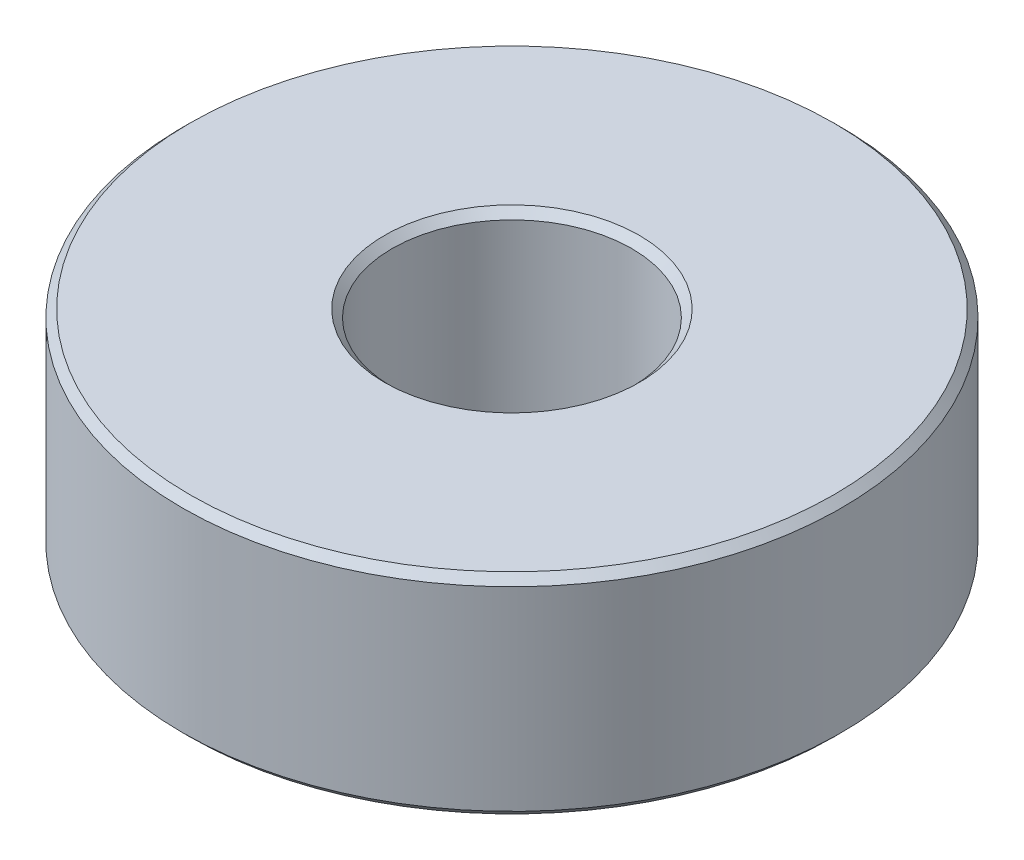
from build123d import *

# Parameters (mm, degrees)
SKETCH1_R           = 11
SKETCH1_R_2         = 4
BOSS_EXTRUDE1_DEPTH = 7
CHAMFER1_SIZE       = 0.254


with BuildPart() as part:
    # Sketch1 → Boss-Extrude1 (new body)
    with BuildSketch(Plane(origin=(0, 0, 0), x_dir=(1, 0, 0), z_dir=(0, 1, 0))):
        with Locations(Location((0, 0, 0), (0, 0, 270))):
            Circle(SKETCH1_R)
        with Locations(Location((0, 0, 0), (0, 0, 270))):
            Circle(SKETCH1_R_2, mode=Mode.SUBTRACT)
    extrude(amount=BOSS_EXTRUDE1_DEPTH)

    # Chamfer1
    chamfer1_edges = [part.edges().sort_by_distance(p)[0] for p in [
        (0, 0, -11),
        (0, 7, -11),
        (0, 0, -4),
        (0, 7, -4),
    ]]
    chamfer(chamfer1_edges, length=CHAMFER1_SIZE)


solid = part.part
